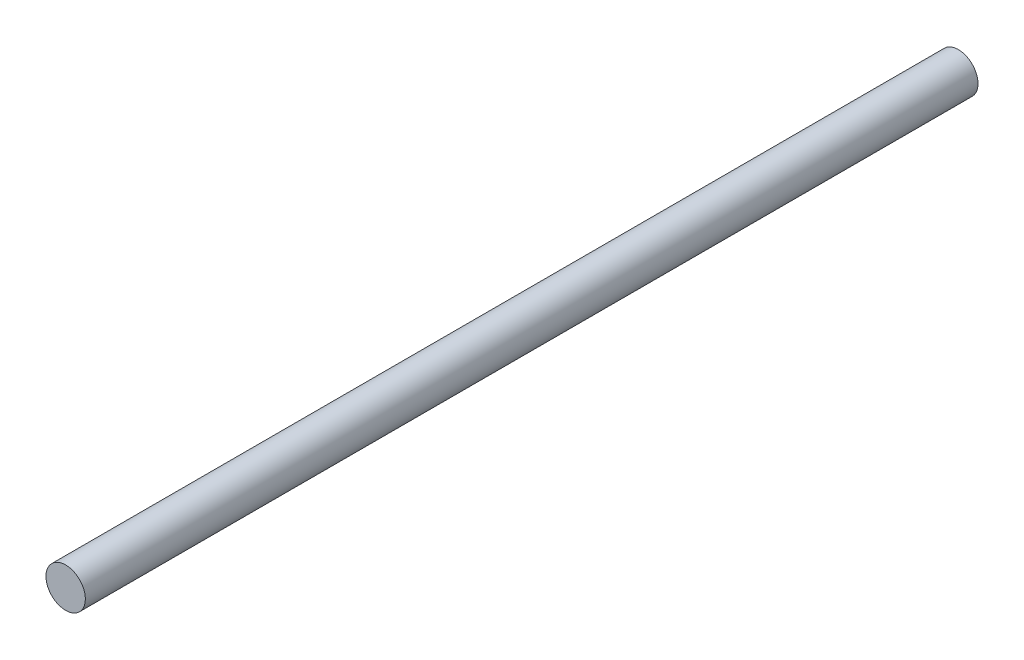
from build123d import *

# Parameters (mm, degrees)
CROQUIS1_R              = 1.5
SALIENTE_EXTRUIR1_DEPTH = 68


with BuildPart() as part:
    # Croquis1 → Saliente-Extruir1 (new body)
    with BuildSketch(Plane.XY):
        Circle(CROQUIS1_R)
    extrude(amount=SALIENTE_EXTRUIR1_DEPTH)


solid = part.part
